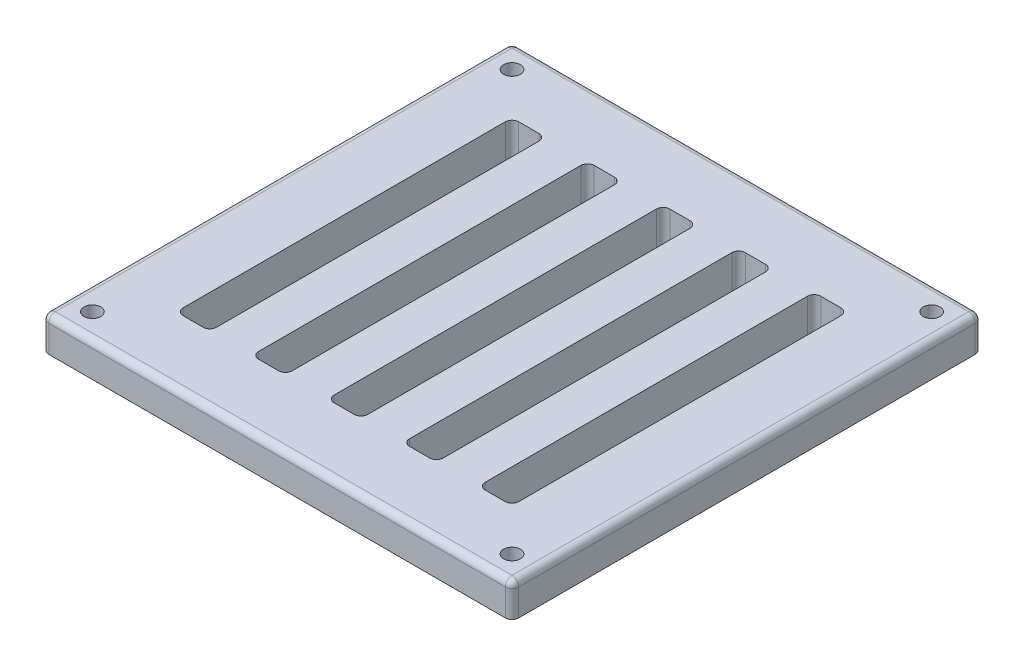
from build123d import *

# Parameters (mm, degrees)
SKETCH1_W                 = 70
SKETCH1_H                 = 70
BOSS_EXTRUDE1_DEPTH       = 5
SKETCH2_R                 = 1.25
CUT_EXTRUDE1_DEPTH        = 100.121138008
LPATTERN1_COUNT           = 2
LPATTERN1_PITCH           = 62.5
LPATTERN2_COUNT           = 2
LPATTERN2_PITCH           = 62.5
LPATTERN2_COPY_1_SKETCH_R = 1.25
LPATTERN2_COPY_1_DEPTH    = 100.121138008
SKETCH3_W                 = 5
SKETCH3_H                 = 50
CUT_EXTRUDE2_DEPTH        = 100.121138008
FILLET2_R                 = 1
FILLET3_R                 = 1
FILLET4_R                 = 1
FILLET5_R                 = 1
LPATTERN3_COUNT           = 5
LPATTERN3_PITCH           = 11.25
FILLET2_OF_LPATTERN3_R    = 1
FILLET3_OF_LPATTERN3_R    = 1
FILLET4_OF_LPATTERN3_R    = 1
FILLET5_OF_LPATTERN3_R    = 1
FILLET6_R                 = 1
FILLET7_R                 = 1
FILLET8_R                 = 1
FILLET9_R                 = 1
FILLET10_R                = 1


with BuildPart() as part:
    # Sketch1 → Boss-Extrude1 (new body)
    with BuildSketch(Plane(origin=(0, 0, 0), x_dir=(1, 0, 0), z_dir=(0, 1, 0))):
        with Locations((35, 35)):
            Rectangle(SKETCH1_W, SKETCH1_H)
    extrude(amount=BOSS_EXTRUDE1_DEPTH)

    # Sketch2 → Cut-Extrude1 (cut, through all)
    with BuildSketch(Plane(origin=(0, 5, 0), x_dir=(1, 0, 0), z_dir=(0, 1, 0))):
        with Locations(Location((3.75, 3.75, 0), (0, 0, 270))):
            Circle(SKETCH2_R)
    cut_extrude1 = extrude(amount=-CUT_EXTRUDE1_DEPTH, mode=Mode.SUBTRACT)

    # LPattern1: Cut-Extrude1 ×2
    with Locations(*[(i * LPATTERN1_PITCH, 0, 0) for i in range(1, LPATTERN1_COUNT)]):
        add(cut_extrude1, mode=Mode.SUBTRACT)

    # LPattern2: Cut-Extrude1 ×2
    with Locations(*[(0, 0, -i * LPATTERN2_PITCH) for i in range(1, LPATTERN2_COUNT)]):
        add(cut_extrude1, mode=Mode.SUBTRACT)

    # LPattern2 copy 1 sketch → LPattern2 copy 1 (cut, through all)
    with BuildSketch(Plane(origin=(62.5, 5, -62.5), x_dir=(1, 0, 0), z_dir=(0, 1, 0))):
        with Locations(Location((3.75, 3.75, 0), (0, 0, 270))):
            Circle(LPATTERN2_COPY_1_SKETCH_R)
    extrude(amount=-LPATTERN2_COPY_1_DEPTH, mode=Mode.SUBTRACT)

    # Sketch3 → Cut-Extrude2 (cut, through all)
    with BuildSketch(Plane(origin=(0, 5, 0), x_dir=(1, 0, 0), z_dir=(0, 1, 0))):
        with Locations((12.5, 35)):
            Rectangle(SKETCH3_W, SKETCH3_H)
    cut_extrude2 = extrude(amount=-CUT_EXTRUDE2_DEPTH, mode=Mode.SUBTRACT)

    # Fillet2
    fillet2_edges = [part.edges().sort_by_distance(p)[0] for p in [
        (10, 2.5, -60),
    ]]
    fillet(fillet2_edges, radius=FILLET2_R)

    # Fillet3
    fillet3_edges = [part.edges().sort_by_distance(p)[0] for p in [
        (15, 2.5, -60),
    ]]
    fillet(fillet3_edges, radius=FILLET3_R)

    # Fillet4
    fillet4_edges = [part.edges().sort_by_distance(p)[0] for p in [
        (10, 2.5, -10),
    ]]
    fillet(fillet4_edges, radius=FILLET4_R)

    # Fillet5
    fillet5_edges = [part.edges().sort_by_distance(p)[0] for p in [
        (15, 2.5, -10),
    ]]
    fillet(fillet5_edges, radius=FILLET5_R)

    # LPattern3: Cut-Extrude2 ×5
    with Locations(*[(i * LPATTERN3_PITCH, 0, 0) for i in range(1, LPATTERN3_COUNT)]):
        add(cut_extrude2, mode=Mode.SUBTRACT)

    # Fillet2 of LPattern3
    fillet2_of_lpattern3_edges = [part.edges().sort_by_distance(p)[0] for p in [
        (21.25, 2.5, -60),
        (32.5, 2.5, -60),
        (43.75, 2.5, -60),
        (55, 2.5, -60),
    ]]
    fillet(fillet2_of_lpattern3_edges, radius=FILLET2_OF_LPATTERN3_R)

    # Fillet3 of LPattern3
    fillet3_of_lpattern3_edges = [part.edges().sort_by_distance(p)[0] for p in [
        (26.25, 2.5, -60),
        (37.5, 2.5, -60),
        (48.75, 2.5, -60),
        (60, 2.5, -60),
    ]]
    fillet(fillet3_of_lpattern3_edges, radius=FILLET3_OF_LPATTERN3_R)

    # Fillet4 of LPattern3
    fillet4_of_lpattern3_edges = [part.edges().sort_by_distance(p)[0] for p in [
        (21.25, 2.5, -10),
        (32.5, 2.5, -10),
        (43.75, 2.5, -10),
        (55, 2.5, -10),
    ]]
    fillet(fillet4_of_lpattern3_edges, radius=FILLET4_OF_LPATTERN3_R)

    # Fillet5 of LPattern3
    fillet5_of_lpattern3_edges = [part.edges().sort_by_distance(p)[0] for p in [
        (26.25, 2.5, -10),
        (37.5, 2.5, -10),
        (48.75, 2.5, -10),
        (60, 2.5, -10),
    ]]
    fillet(fillet5_of_lpattern3_edges, radius=FILLET5_OF_LPATTERN3_R)

    # Fillet6
    fillet6_edges = [part.edges().sort_by_distance(p)[0] for p in [
        (70, 2.5, 0),
    ]]
    fillet(fillet6_edges, radius=FILLET6_R)

    # Fillet7
    fillet7_edges = [part.edges().sort_by_distance(p)[0] for p in [
        (0, 2.5, 0),
    ]]
    fillet(fillet7_edges, radius=FILLET7_R)

    # Fillet8
    fillet8_edges = [part.edges().sort_by_distance(p)[0] for p in [
        (0, 2.5, -70),
    ]]
    fillet(fillet8_edges, radius=FILLET8_R)

    # Fillet9
    fillet9_edges = [part.edges().sort_by_distance(p)[0] for p in [
        (70, 2.5, -70),
    ]]
    fillet(fillet9_edges, radius=FILLET9_R)

    # Fillet10
    fillet10_edges = [part.edges().sort_by_distance(p)[0] for p in [
        (70, 5, -35),
        (69.707106781, 5, -0.292893219),
        (35, 5, 0),
        (0.292893219, 5, -0.292893219),
        (0, 5, -35),
        (0.292893219, 5, -69.707106781),
        (35, 5, -70),
        (69.707106781, 5, -69.707106781),
    ]]
    fillet(fillet10_edges, radius=FILLET10_R)


solid = part.part
